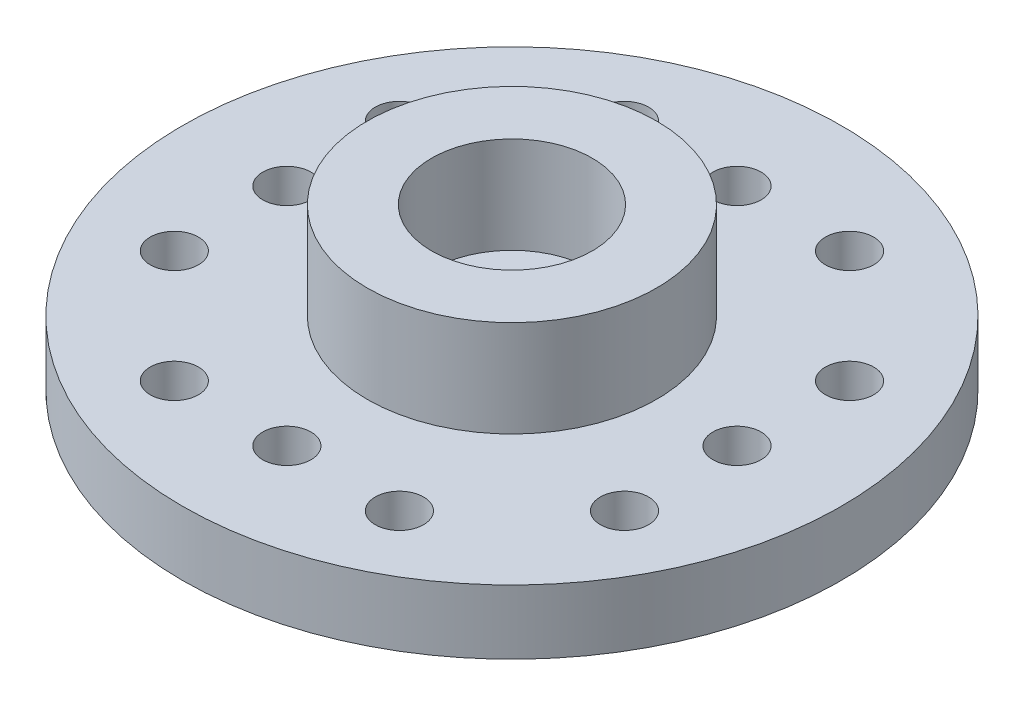
from build123d import *

# Parameters (mm, degrees)
SKETCH1_R           = 10.25
BOSS_EXTRUDE1_DEPTH = 2
SKETCH2_R           = 4.5
SKETCH2_R_2         = 2.5
BOSS_EXTRUDE2_DEPTH = 3
SKETCH3_R           = 1.5
CUT_EXTRUDE1_DEPTH  = 16.333786225
SKETCH4_R           = 0.75
CUT_EXTRUDE2_DEPTH  = 16.333786225
CIRPATTERN1_COUNT   = 4


with BuildPart() as part:
    # Sketch1 → Boss-Extrude1 (new body)
    with BuildSketch(Plane(origin=(0, 0, 0), x_dir=(1, 0, 0), z_dir=(0, 1, 0))):
        with Locations(Location((0, 0, 0), (0, 0, 270))):
            Circle(SKETCH1_R)
    extrude(amount=BOSS_EXTRUDE1_DEPTH)

    # Sketch2 → Boss-Extrude2 (add)
    with BuildSketch(Plane(origin=(0, 2, 0), x_dir=(1, 0, 0), z_dir=(0, 1, 0))):
        with Locations(Location((0, 0, 0), (0, 0, 270))):
            Circle(SKETCH2_R)
        with Locations(Location((0, 0, 0), (0, 0, 270))):
            Circle(SKETCH2_R_2, mode=Mode.SUBTRACT)
    extrude(amount=BOSS_EXTRUDE2_DEPTH)

    # Sketch3 → Cut-Extrude1 (cut, through all)
    with BuildSketch(Plane.XZ):
        with Locations(Location((0, 0, 0), (0, 0, 270))):
            Circle(SKETCH3_R)
    extrude(amount=-CUT_EXTRUDE1_DEPTH, mode=Mode.SUBTRACT)

    # Sketch4 → Cut-Extrude2 (cut, through all)
    with BuildSketch(Plane.XZ):
        with Locations(Location((0, 7, 0), (0, 0, 270))):
            Circle(SKETCH4_R)
        with Locations(Location((-3.5, 7, 0), (0, 0, 270))):
            Circle(SKETCH4_R)
        with Locations(Location((3.5, 7, 0), (0, 0, 270))):
            Circle(SKETCH4_R)
    cut_extrude2 = extrude(amount=-CUT_EXTRUDE2_DEPTH, mode=Mode.SUBTRACT)

    # CirPattern1: Cut-Extrude2 ×4 about axis
    cirpattern1_axis = Axis((0, 0, 0), (0, 1, 0))
    for i in range(1, CIRPATTERN1_COUNT):
        add(cut_extrude2.rotate(cirpattern1_axis, i * 360 / CIRPATTERN1_COUNT), mode=Mode.SUBTRACT)


solid = part.part
